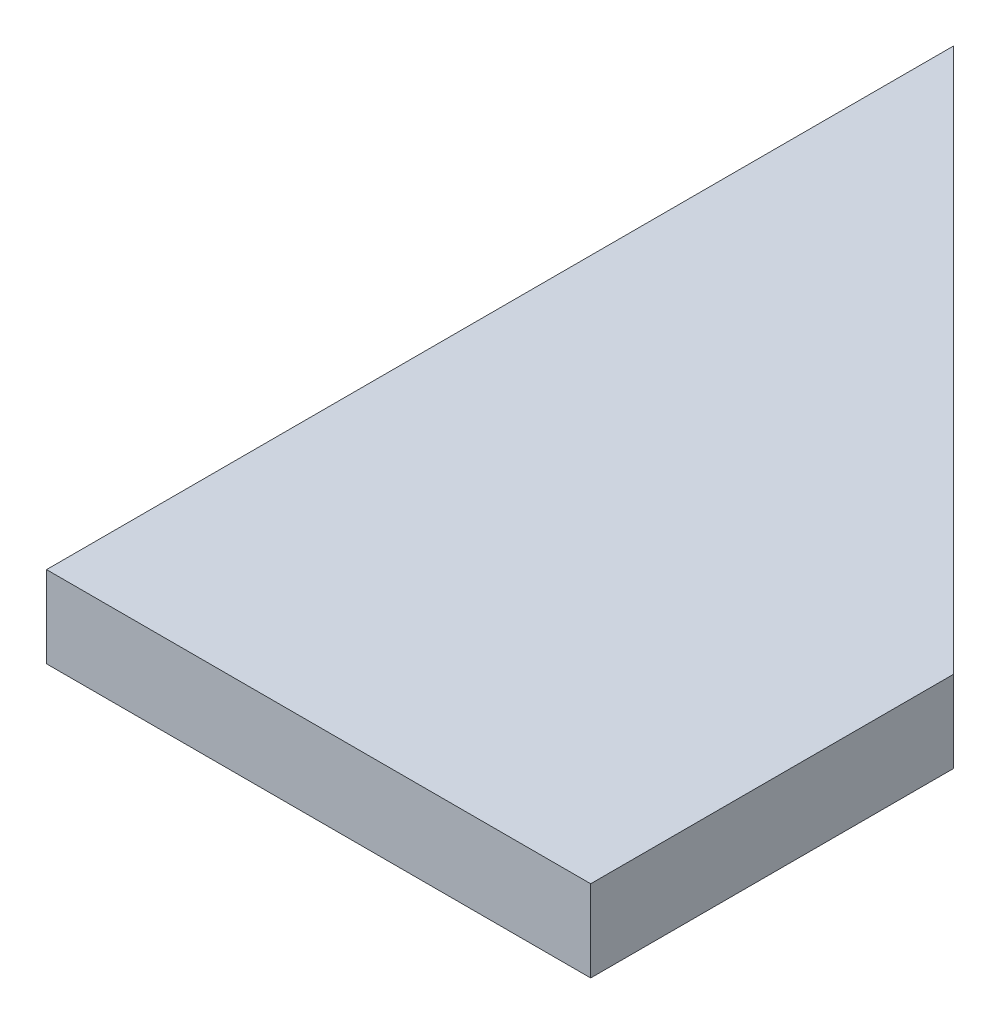
from build123d import *

# Parameters (mm, degrees)
BOSS_EXTRUDE1_DEPTH = 4.5


with BuildPart() as part:
    # Sketch2 → Boss-Extrude1 (new body)
    with BuildSketch(Plane(origin=(0, 0, 0), x_dir=(1, 0, 0), z_dir=(0, 1, 0))):
        Polygon((0, 0), (30, 0), (30, 20), (0, 50), align=None)
    extrude(amount=BOSS_EXTRUDE1_DEPTH)


solid = part.part
